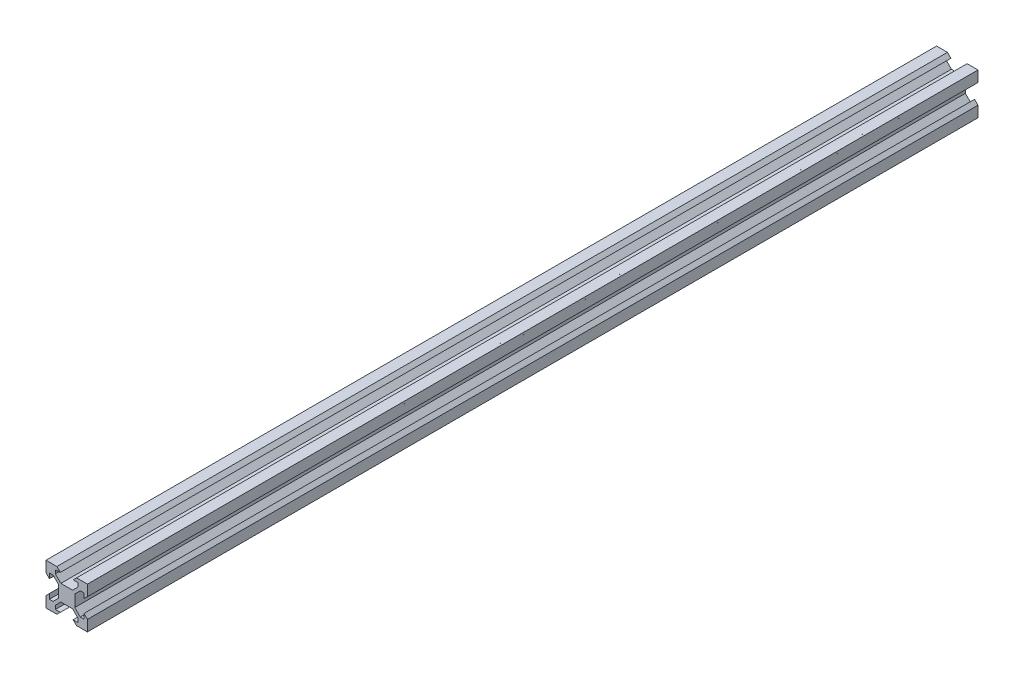
from build123d import *

# Parameters (mm, degrees)
BOSS_EXTRUDE1_DEPTH = 430


with BuildPart() as part:
    # Sketch1 → Boss-Extrude1 (new body)
    with BuildSketch(Plane.XY):
        Polygon((2.834320347, 3.893970342), (-2.834320347, 3.893970342), (-5.5, 6.558849663), (-5.5, 8.349069506), (-3.1, 8.349069506), (-4.75, 9.998574117), (-10, 9.998574117), (-10, 4.746997406), (-8.35, 3.097492795), (-8.350720674, 5.497492687), (-6.560500912, 5.498030255), (-3.894821259, 2.833150935), (-3.894821259, -2.833150935), (-6.560500912, -5.498030255), (-8.350720674, -5.497492687), (-8.35, -3.097492795), (-10, -4.746997406), (-10, -9.998574117), (-4.75, -9.998574117), (-3.1, -8.349069506), (-5.5, -8.349069506), (-5.5, -6.558849663), (-2.834320347, -3.893970342), (2.834320347, -3.893970342), (5.5, -6.558849663), (5.5, -8.349069506), (3.1, -8.349069506), (4.75, -9.998574117), (10, -9.998574117), (10, -4.746997406), (8.35, -3.097492795), (8.350720674, -5.497492687), (6.560500912, -5.498030255), (3.894821259, -2.833150935), (3.894821259, 2.833150935), (6.560500912, 5.498030255), (8.350720674, 5.497492687), (8.35, 3.097492795), (10, 4.746997406), (10, 9.998574117), (4.75, 9.998574117), (3.1, 8.349069506), (5.5, 8.349069506), (5.5, 6.558849663), align=None)
    extrude(amount=BOSS_EXTRUDE1_DEPTH)


solid = part.part
